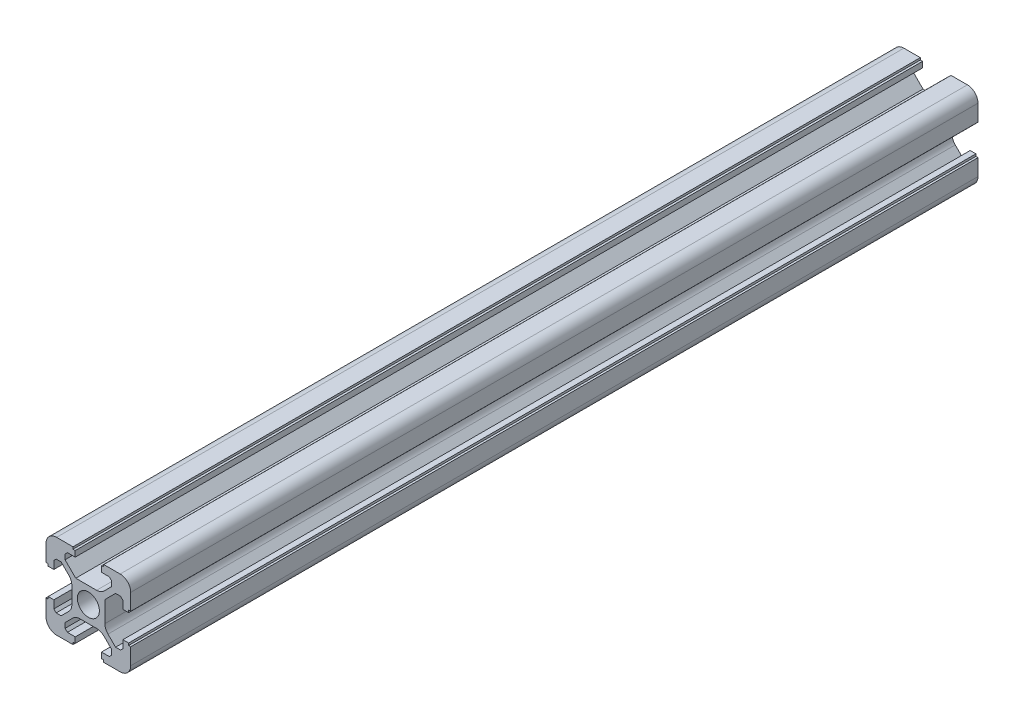
from build123d import *

# Parameters (mm, degrees)
SKETCH1_W           = 16.3
SKETCH1_H           = 16.3
SKETCH1_W_2         = 11
SKETCH1_H_2         = 11
SKETCH1_R           = 2.6
BOSS_EXTRUDE1_DEPTH = 200
CUT_EXTRUDE2_DEPTH  = 201.499376558
FILLET1_R           = 2.5
FILLET2_R           = 2.5
SKETCH3_W           = 1
SKETCH3_H           = 7.25
SKETCH3_W_2         = 7.25
SKETCH3_H_2         = 1
CUT_EXTRUDE3_DEPTH  = 201.499376558


with BuildPart() as part:
    # Sketch1 → Boss-Extrude1 (new body)
    # profile 1 of 6: a face of its own
    with BuildSketch(Plane.XY):
        Polygon((-3.1, 8.15), (-3.1, 10), (-10, 10), (-10, 3.1), (-8.15, 3.1), (-8.15, 8.15), align=None)
    # profile 2 of 6: a face of its own
    with BuildSketch(Plane.XY):
        Polygon((10, 10), (3.1, 10), (3.1, 8.15), (8.15, 8.15), (8.15, 3.1), (10, 3.1), align=None)
    # profile 3 of 6: a face of its own
    with BuildSketch(Plane.XY):
        Rectangle(SKETCH1_W, SKETCH1_H)
        Rectangle(SKETCH1_W_2, SKETCH1_H_2, mode=Mode.SUBTRACT)
    # profile 4 of 6: a face of its own
    with BuildSketch(Plane.XY):
        Polygon((10, -10), (10, -3.1), (8.15, -3.1), (8.15, -8.15), (3.1, -8.15), (3.1, -10), align=None)
    # profile 5 of 6: a face of its own
    with BuildSketch(Plane.XY):
        Polygon((-8.15, -3.1), (-10, -3.1), (-10, -10), (-3.1, -10), (-3.1, -8.15), (-8.15, -8.15), align=None)
    # profile 6 of 6: a face of its own
    with BuildSketch(Plane.XY):
        Rectangle(SKETCH1_W_2, SKETCH1_H_2)
        Circle(SKETCH1_R, mode=Mode.SUBTRACT)
    extrude(amount=BOSS_EXTRUDE1_DEPTH)

    # Sketch2 → Cut-Extrude2 (cut, through all)
    with BuildSketch(Plane.XY.offset(200)):
        Polygon((-5.5, -4.580761184), (-5.5, 4.580761184), (-6.419238816, 5.5), (-7.6, 5.5), (-8.15, 4.95), (-8.15, 3.1), (-8.15, -3.1), (-8.15, -4.95), (-7.6, -5.5), (-6.419238816, -5.5), align=None)
        Polygon((-3.9, -2.980761184), (-3.9, 2.980761184), (-5.5, 4.580761184), (-5.5, -4.580761184), align=None)
        Polygon((-5.5, 6.419238816), (-4.580761184, 5.5), (4.580761184, 5.5), (5.5, 6.419238816), (5.5, 7.6), (4.95, 8.15), (3.1, 8.15), (-3.1, 8.15), (-4.95, 8.15), (-5.5, 7.6), align=None)
        Polygon((-4.580761184, 5.5), (-2.980761184, 3.9), (2.980761184, 3.9), (4.580761184, 5.5), align=None)
        Polygon((6.419238816, 5.5), (5.5, 4.580761184), (5.5, -4.580761184), (6.419238816, -5.5), (7.6, -5.5), (8.15, -4.95), (8.15, -3.1), (8.15, 3.1), (8.15, 4.95), (7.6, 5.5), align=None)
        Polygon((5.5, 4.580761184), (3.9, 2.980761184), (3.9, -2.980761184), (5.5, -4.580761184), align=None)
        Polygon((4.580761184, -5.5), (-4.580761184, -5.5), (-5.5, -6.419238816), (-5.5, -7.6), (-4.95, -8.15), (-3.1, -8.15), (3.1, -8.15), (4.95, -8.15), (5.5, -7.6), (5.5, -6.419238816), align=None)
        Polygon((2.980761184, -3.9), (-2.980761184, -3.9), (-4.580761184, -5.5), (4.580761184, -5.5), align=None)
    extrude(amount=-CUT_EXTRUDE2_DEPTH, mode=Mode.SUBTRACT)

    # Fillet1
    fillet1_edges = [part.edges().sort_by_distance(p)[0] for p in [
        (-10, -10, 100),
        (-10, 10, 100),
        (10, 10, 100),
        (10, -10, 100),
    ]]
    fillet(fillet1_edges, radius=FILLET1_R)

    # Fillet2
    fillet2_edges = [part.edges().sort_by_distance(p)[0] for p in [
        (2.980761184, 3.9, 100),
        (3.9, -2.980761184, 100),
        (-2.980761184, -3.9, 100),
        (2.980761184, -3.9, 100),
        (-3.9, 2.980761184, 100),
        (-3.9, -2.980761184, 100),
    ]]
    fillet(fillet2_edges, radius=FILLET2_R)

    # Sketch3 → Cut-Extrude3 (cut, through all)
    with BuildSketch(Plane.XY.offset(200)):
        with Locations((10, 0)):
            Rectangle(SKETCH3_W, SKETCH3_H)
        with Locations((0, 10)):
            Rectangle(SKETCH3_W_2, SKETCH3_H_2)
        with Locations((0, -10)):
            Rectangle(SKETCH3_W_2, SKETCH3_H_2)
        with Locations((-10, 0)):
            Rectangle(SKETCH3_W, SKETCH3_H)
    extrude(amount=-CUT_EXTRUDE3_DEPTH, mode=Mode.SUBTRACT)


solid = part.part
